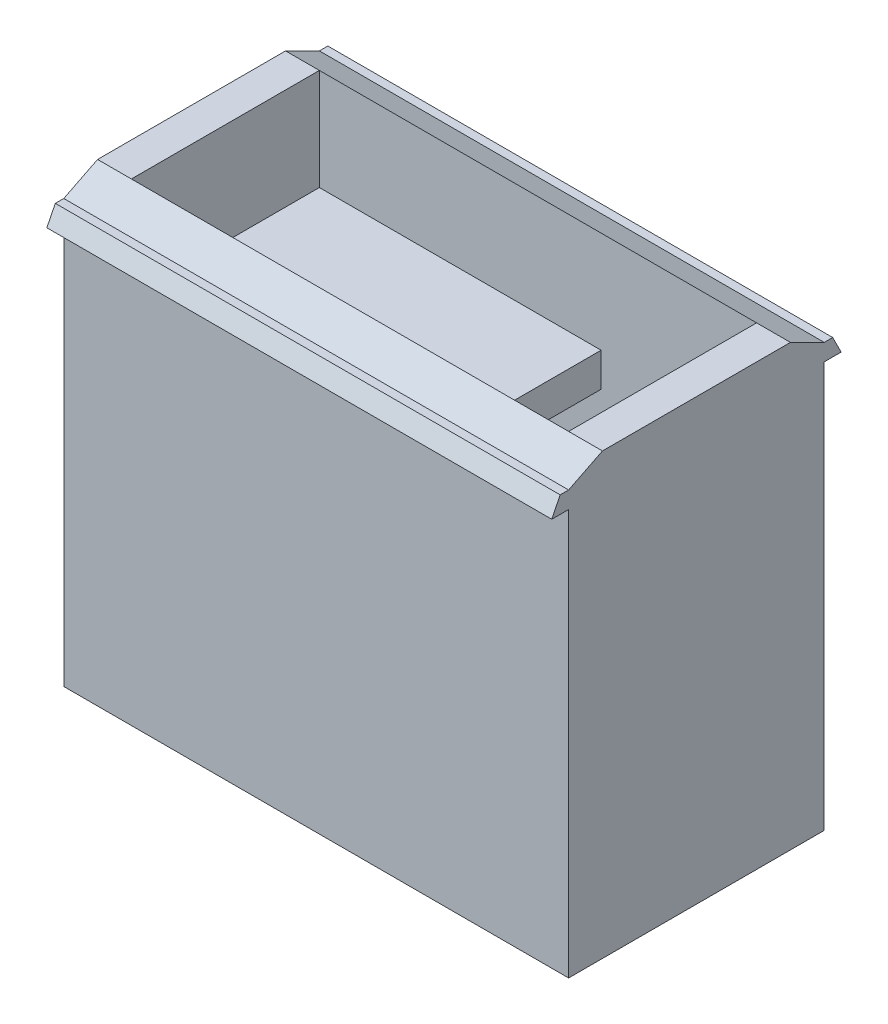
from build123d import *

# Parameters (mm, degrees)
BOSS_EXTRUDE1_DEPTH = 10
SKETCH2_W           = 1.866494487
SKETCH2_H           = 2.78
SKETCH2_H_2         = 1
BOSS_EXTRUDE2_DEPTH = 1
BOSS_EXTRUDE3_DEPTH = 3
SKETCH4_W           = 14.931955898
SKETCH4_H           = 1
BOSS_EXTRUDE4_DEPTH = 1
SKETCH5_W           = 14.931955898
SKETCH5_H           = 0.998682686
BOSS_EXTRUDE5_DEPTH = 1
CUT_EXTRUDE1_DEPTH  = 15
CUT_EXTRUDE2_DEPTH  = 15
CUT_EXTRUDE3_DEPTH  = 15


with BuildPart() as part:
    # Sketch1 → Boss-Extrude1 (new body)
    with BuildSketch(Plane(origin=(0, 0, 0), x_dir=(1, 0, 0), z_dir=(0, 1, 0))):
        Polygon((-13.931955898, 6.56), (-13.931955898, -1), (-13, -1), (-13, 0), (-13, 5.56), (0, 5.56), (0, 0), (1, 0), (1, 5.56), (1, 6.56), (-12.931955898, 6.56), align=None)
        Polygon((0, -1), (1, -1), (1, 0), (0, 0), (-13, 0), (-13, -1), align=None)
    extrude(amount=BOSS_EXTRUDE1_DEPTH)

    # Sketch2 → Boss-Extrude2 (add)
    with BuildSketch(Plane(origin=(0, 10, 0), x_dir=(1, 0, 0), z_dir=(0, 1, 0))):
        Polygon((-13, 0), (-6.465977949, 0), (-6.465977949, 2.78), (-6.465977949, 5.56), (-13, 5.56), align=None)
        with Locations((-5.532730706, 4.17)):
            Rectangle(SKETCH2_W, SKETCH2_H)
        with Locations((-5.532730706, 1.39)):
            Rectangle(SKETCH2_W, SKETCH2_H)
        Polygon((-13.931955898, -1), (-6.465977949, -1), (-6.465977949, 0), (-13, 0), (-13, 5.56), (-6.465977949, 5.56), (-6.465977949, 6.56), (-13.931955898, 6.56), align=None)
        with Locations((-5.532730706, -0.5)):
            Rectangle(SKETCH2_W, SKETCH2_H_2)
        with Locations((-5.532730706, 6.06)):
            Rectangle(SKETCH2_W, SKETCH2_H_2)
    extrude(amount=-BOSS_EXTRUDE2_DEPTH)

    # Sketch3 → Boss-Extrude3 (add)
    with BuildSketch(Plane(origin=(0, 10, 0), x_dir=(1, 0, 0), z_dir=(0, 1, 0))):
        Polygon((1, 6.56), (-12.931955898, 6.56), (-12.931955898, 5.56), (-4.599483462, 5.56), (0, 5.56), (0, 0), (-4.599483462, 0), (-12.931955898, 0), (-12.931955898, -1), (1, -1), align=None)
        Polygon((-12.931955898, 6.56), (-13.931955898, 6.56), (-13.931955898, -1), (-12.931955898, -1), (-12.931955898, 0), (-12.931955898, 5.56), align=None)
    extrude(amount=BOSS_EXTRUDE3_DEPTH)

    # Sketch4 → Boss-Extrude4 (add)
    with BuildSketch(Plane.XY.offset(1)):
        with Locations((-6.465977949, 12.5)):
            Rectangle(SKETCH4_W, SKETCH4_H)
    extrude(amount=BOSS_EXTRUDE4_DEPTH)

    # Sketch5 → Boss-Extrude5 (add)
    with BuildSketch(Plane(origin=(0, 0, -6.56), x_dir=(-1, 0, 0), z_dir=(0, 0, -1))):
        with Locations((6.465977949, 12.500658657)):
            Rectangle(SKETCH5_W, SKETCH5_H)
    extrude(amount=BOSS_EXTRUDE5_DEPTH)

    # Sketch6 → Cut-Extrude1 (cut)
    with BuildSketch(Plane.ZY.offset(13.931955898)):
        Polygon((-7.56, 12.001317314), (-6.56, 13), (-7.56, 13), align=None)
        Polygon((1, 13), (2, 12), (2, 13), align=None)
    extrude(amount=-CUT_EXTRUDE1_DEPTH, mode=Mode.SUBTRACT)

    # Sketch7 → Cut-Extrude2 (cut)
    with BuildSketch(Plane(origin=(1, 0, 0), x_dir=(0, 0, -1), z_dir=(1, 0, 0))):
        Polygon((-1.5, 12), (-1, 13), (-2, 12), align=None)
        Polygon((7.56, 12.001317314), (6.56, 13), (7.06, 12.001317314), align=None)
    extrude(amount=-CUT_EXTRUDE2_DEPTH, mode=Mode.SUBTRACT)

    # Sketch12 → Cut-Extrude3 (cut)
    with BuildSketch(Plane.ZY.offset(13.931955898)):
        Polygon((-6.81, 12.500658657), (-6.56, 12.500658657), (-6.56, 13), align=None)
        Polygon((-6.56, 13), (-6.56, 12.500658657), (-5.56, 13), align=None)
        Polygon((1.25, 12.5), (1, 13), (1, 12.5), align=None)
        Polygon((1, 12.5), (1, 13), (0, 13), align=None)
    extrude(amount=-CUT_EXTRUDE3_DEPTH, mode=Mode.SUBTRACT)


solid = part.part
